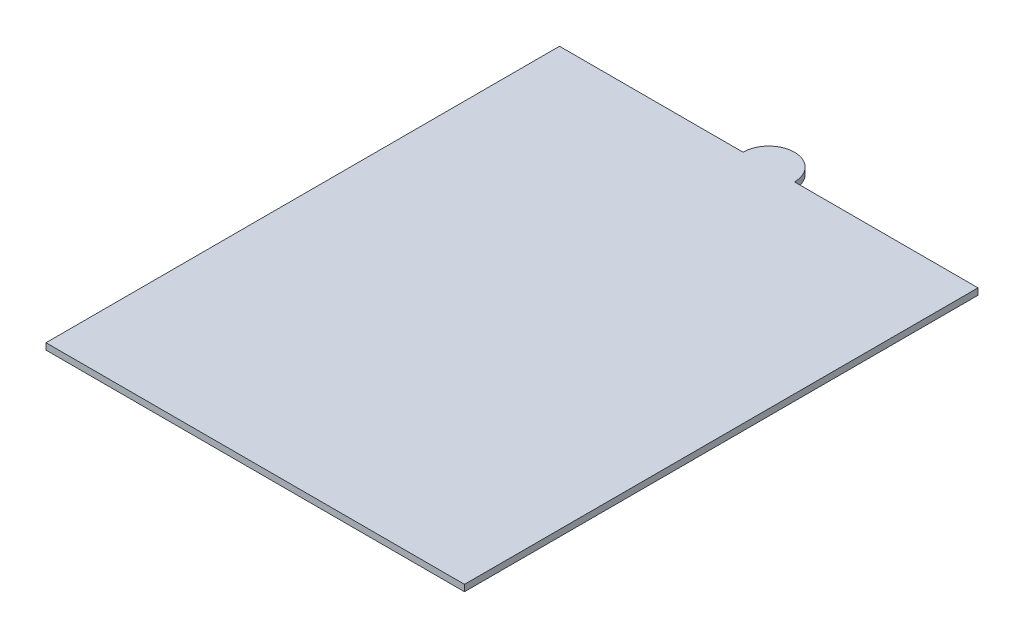
from build123d import *

# Parameters (mm, degrees)
BOSS_EXTRUDE1_DEPTH = 3.175


with BuildPart() as part:
    # Sketch1 → Boss-Extrude1 (new body)
    with BuildSketch(Plane(origin=(0, 0, 0), x_dir=(1, 0, 0), z_dir=(0, 1, 0))):
        with BuildLine():
            Line((12.7, 126.619), (103.1875, 126.619))
            Line((103.1875, 126.619), (103.1875, -126.619))
            Line((103.1875, -126.619), (-103.1875, -126.619))
            Line((-103.1875, -126.619), (-103.1875, 126.619))
            Line((-103.1875, 126.619), (-12.7, 126.619))
            ThreePointArc((-12.7, 126.619), (0, 139.319), (12.7, 126.619))
        make_face()
    extrude(amount=BOSS_EXTRUDE1_DEPTH)


solid = part.part
